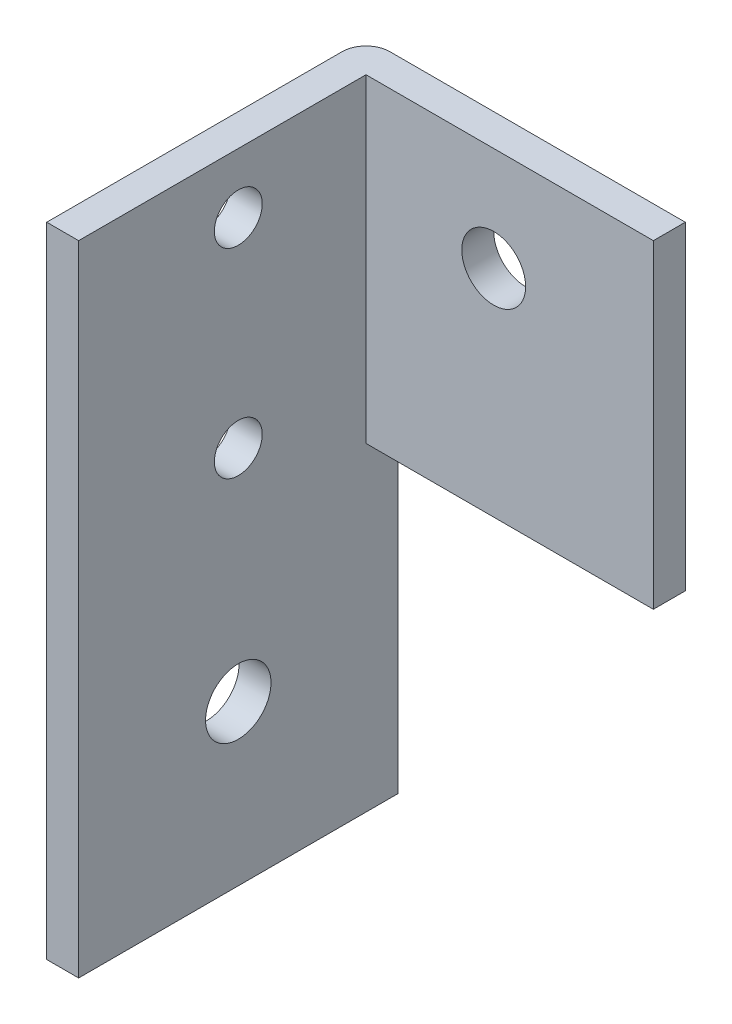
from build123d import *

# Parameters (mm, degrees)
EXTRUDE_THIN1_DEPTH   = 80
SKETCH5_R             = 4.1
SKETCH5_R_2           = 3
CUT_EXTRUDE2_DEPTH    = 10
SKETCH6_W             = 57.412547925
SKETCH6_H             = 40
CUT_EXTRUDE3_DEPTH    = 10
F_8_0MM_DOWEL_HOLE1_D = 8


with BuildPart() as part:
    # Sketch1 → Extrude-Thin1 (new body)
    with BuildSketch(Plane(origin=(0, 0, 0), x_dir=(1, 0, 0), z_dir=(0, 1, 0))):
        with BuildLine():
            Line((-22.658959538, -16.878612717), (-22.658959538, 20.121387283))
            ThreePointArc((-22.658959538, 20.121387283), (-21.780279881, 22.242707627), (-19.658959538, 23.121387283))
            Line((-19.658959538, 23.121387283), (17.341040462, 23.121387283))
            Line((17.341040462, 23.121387283), (17.341040462, 19.121387283))
            Line((17.341040462, 19.121387283), (-18.658959538, 19.121387283))
            Line((-18.658959538, 19.121387283), (-18.658959538, -16.878612717))
            Line((-18.658959538, -16.878612717), (-22.658959538, -16.878612717))
        make_face()
    extrude(amount=EXTRUDE_THIN1_DEPTH)

    # Sketch5 → Cut-Extrude2 (cut)
    with BuildSketch(Plane.ZY.offset(22.658959538)):
        with Locations((-3.121387283, 20)):
            Circle(SKETCH5_R)
        with Locations((-3.121387283, 47.5)):
            Circle(SKETCH5_R_2)
        with Locations((-3.121387283, 72.5)):
            Circle(SKETCH5_R_2)
    extrude(amount=-CUT_EXTRUDE2_DEPTH, mode=Mode.SUBTRACT)

    # Sketch6 → Cut-Extrude3 (cut)
    with BuildSketch(Plane(origin=(0, 0, -23.121387283), x_dir=(-1, 0, 0), z_dir=(0, 0, -1))):
        with Locations((-10.047314424, 20)):
            Rectangle(SKETCH6_W, SKETCH6_H)
    extrude(amount=-CUT_EXTRUDE3_DEPTH, mode=Mode.SUBTRACT)

    # Ø8.0mm Dowel Hole1 (through all)
    with Locations(Plane(origin=(0, 0, -23.121387283), x_dir=(-1, 0, 0), z_dir=(0, 0, -1))):
        with Locations((2.658959538, 67)):
            Hole(F_8_0MM_DOWEL_HOLE1_D / 2)


solid = part.part
